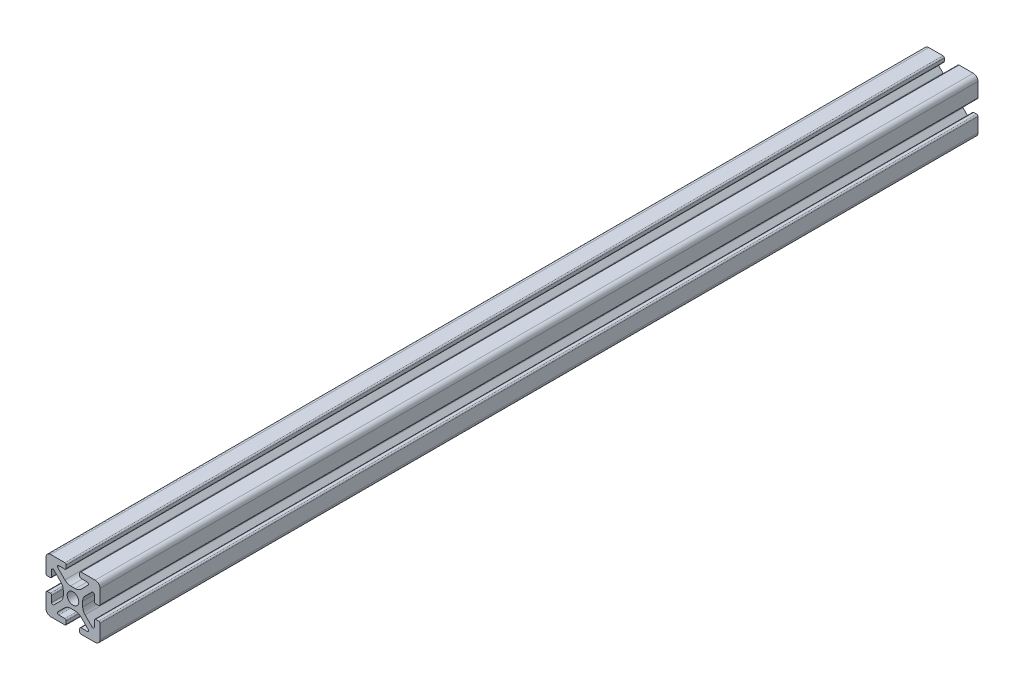
from build123d import *

# Parameters (mm, degrees)
BOSS_EXTRUDE1_DEPTH = 304.8
SKETCH5_W           = 26.995197012
SKETCH5_H           = 24.68705749
CUT_EXTRUDE1_DEPTH  = 284.025


with BuildPart() as part:
    # Sketch4 → Boss-Extrude1 (new, symmetric)
    with BuildSketch(Plane.XY):
        with BuildLine():
            Line((3, -10), (8.25, -10))
            ThreePointArc((8.25, -10), (9.487436867, -9.487436867), (10, -8.25))
            Line((10, -8.25), (10, -3))
            ThreePointArc((10, -3), (9.853553391, -2.646446609), (9.5, -2.5))
            Line((9.5, -2.5), (8.424621202, -2.5))
            ThreePointArc((8.424621202, -2.5), (8.071067812, -2.646446609), (7.924621202, -3))
            Line((7.924621202, -3), (7.924621202, -5.25))
            ThreePointArc((7.924621202, -5.25), (7.615962919, -5.711939766), (7.071067812, -5.603553391))
            Line((7.071067812, -5.603553391), (4.478679656, -3.011165235))
            ThreePointArc((4.478679656, -3.011165235), (3.828361402, -2.037895189), (3.6, -0.889844892))
            Line((3.6, -0.889844892), (3.6, 0))
            Line((3.6, 0), (2.15, 0))
            ThreePointArc((2.15, 0), (1.52027958, -1.52027958), (0, -2.15))
            Line((0, -2.15), (0, -3.6))
            Line((0, -3.6), (0.889844892, -3.6))
            ThreePointArc((0.889844892, -3.6), (2.037895189, -3.828361402), (3.011165235, -4.478679656))
            Line((3.011165235, -4.478679656), (5.603553391, -7.071067812))
            ThreePointArc((5.603553391, -7.071067812), (5.711939766, -7.615962919), (5.25, -7.924621202))
            Line((5.25, -7.924621202), (3, -7.924621202))
            ThreePointArc((3, -7.924621202), (2.646446609, -8.071067812), (2.5, -8.424621202))
            Line((2.5, -8.424621202), (2.5, -9.5))
            ThreePointArc((2.5, -9.5), (2.646446609, -9.853553391), (3, -10))
        make_face()
    extrude(amount=BOSS_EXTRUDE1_DEPTH, both=True)

    # Mirror1: part across plane


with BuildPart() as part_1:
    add(part.part)
    add(part.part.mirror(Plane(origin=(0, 0, 0), x_dir=(0, 0, 1), z_dir=(1, 0, 0))))

    # Mirror2: part across plane


with BuildPart() as part_2:
    add(part_1.part)
    add(part_1.part.mirror(Plane.ZX))

    # Sketch5 → Cut-Extrude1 (cut)
    with BuildSketch(Plane(origin=(0, 0, -304.8), x_dir=(-1, 0, 0), z_dir=(0, 0, -1))):
        with Locations((-0.333544011, -0.025224209)):
            Rectangle(SKETCH5_W, SKETCH5_H)
    extrude(amount=-CUT_EXTRUDE1_DEPTH, mode=Mode.SUBTRACT)


solid = part_2.part
